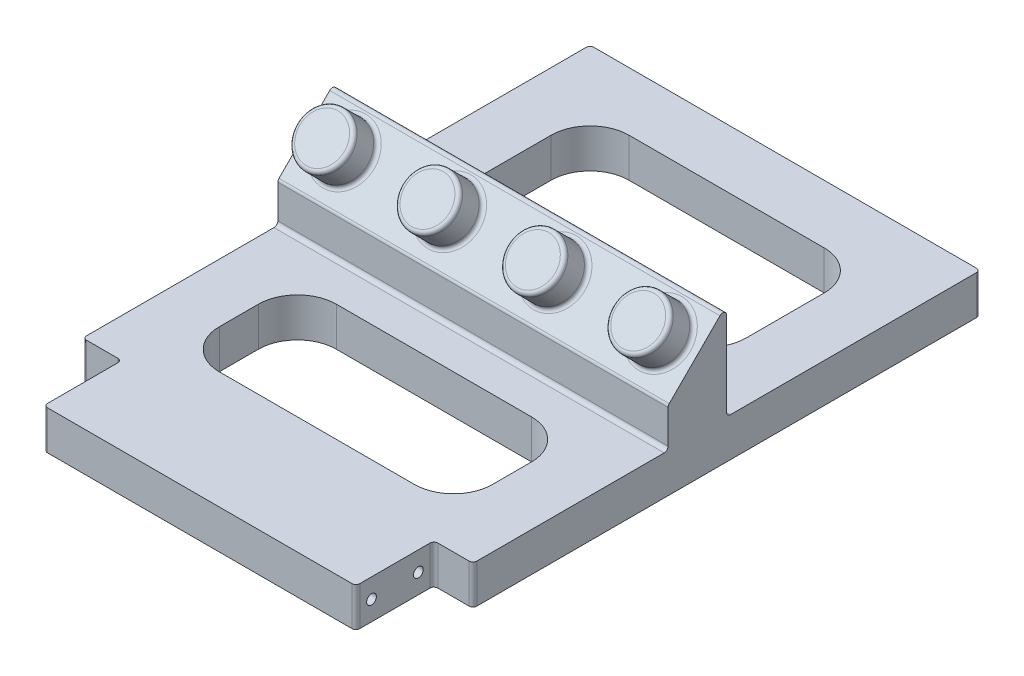
from build123d import *

# Parameters (mm, degrees)
SKETCH_1_W          = 100
SKETCH_1_H          = 150
EXTRUDE_1_DEPTH     = 5
SKETCH_6_W          = 20
SKETCH_6_H          = 10
CUT_EXTRUDE_2_DEPTH = 10
SKETCH_8_R          = 1.25
CUT_EXTRUDE_3_DEPTH = 15
EXTRUDE_3_DEPTH     = 100
SKETCH_10_R         = 6.75
EXTRUDE_4_DEPTH     = 8
FILLET_1_R          = 1
FILLET_2_R          = 1
SKETCH_11_W         = 70
SKETCH_11_H         = 40
SKETCH_11_H_2       = 30
CUT_EXTRUDE_4_DEPTH = 95.24494087
FILLET_3_R          = 10


with BuildPart() as part:
    # 草图1 → 凸台-拉伸1 (new, symmetric)
    with BuildSketch(Plane(origin=(0, 0, 0), x_dir=(1, 0, 0), z_dir=(0, 1, 0))):
        Rectangle(SKETCH_1_W, SKETCH_1_H)
    extrude(amount=EXTRUDE_1_DEPTH, both=True)

    # 草图6 → 切除-拉伸2 (cut)
    with BuildSketch(Plane(origin=(50, 0, 0), x_dir=(0, 0, -1), z_dir=(1, 0, 0))):
        with Locations((-65, 0)):
            Rectangle(SKETCH_6_W, SKETCH_6_H)
    cut_extrude_2 = extrude(amount=-CUT_EXTRUDE_2_DEPTH, mode=Mode.SUBTRACT)

    # 草图8 → 切除-拉伸3 (cut)
    with BuildSketch(Plane(origin=(40, 0, 0), x_dir=(0, 0, -1), z_dir=(1, 0, 0))):
        with Locations((-71, 0)):
            Circle(SKETCH_8_R)
        with Locations((-59, 0)):
            Circle(SKETCH_8_R)
    cut_extrude_3 = extrude(amount=-CUT_EXTRUDE_3_DEPTH, mode=Mode.SUBTRACT)

    # 镜向1: 切除-拉伸2, 切除-拉伸3 across plane
    add(cut_extrude_2.mirror(Plane(origin=(0, 0, 0), x_dir=(0, 0, 1), z_dir=(1, 0, 0))), mode=Mode.SUBTRACT)
    add(cut_extrude_3.mirror(Plane(origin=(0, 0, 0), x_dir=(0, 0, 1), z_dir=(1, 0, 0))), mode=Mode.SUBTRACT)

    # 草图9 → 凸台-拉伸3 (add)
    with BuildSketch(Plane(origin=(50, 0, 0), x_dir=(0, 0, -1), z_dir=(1, 0, 0))):
        Polygon((-5, 15), (-5, 5), (10, 5), (10, 15), (10, 30), align=None)
    extrude(amount=-EXTRUDE_3_DEPTH)

    # 草图10 → 凸台-拉伸4 (add)
    with BuildSketch(Plane(origin=(0, 10, 10), x_dir=(1, 0, 0), z_dir=(0, 0.7071067811865461, 0.7071067811865489))):
        with Locations(Location((40.5, 17.67766953, 0), (0, 0, 270))):
            Circle(SKETCH_10_R)
        with Locations(Location((-40.5, 17.67766953, 0), (0, 0, 270))):
            Circle(SKETCH_10_R)
        with Locations(Location((-13.5, 17.67766953, 0), (0, 0, 270))):
            Circle(SKETCH_10_R)
        with Locations(Location((13.5, 17.67766953, 0), (0, 0, 270))):
            Circle(SKETCH_10_R)
    extrude(amount=EXTRUDE_4_DEPTH)

    # 圆角1
    fillet_1_edges = [part.edges().sort_by_distance(p)[0] for p in [
        (-40.5, 27.272970773, -7.272970773),
        (-40.5, 32.929825023, -1.616116524),
        (40.5, 27.272970773, -7.272970773),
        (40.5, 32.929825023, -1.616116524),
        (-13.5, 27.272970773, -7.272970773),
        (-13.5, 32.929825023, -1.616116524),
        (13.5, 27.272970773, -7.272970773),
        (13.5, 32.929825023, -1.616116524),
        (0, 5, -10),
        (0, 5, 5),
        (0, 15, 5),
        (0, 30, -10),
    ]]
    fillet(fillet_1_edges, radius=FILLET_1_R)

    # 圆角2
    fillet_2_edges = [part.edges().sort_by_distance(p)[0] for p in [
        (40, 0, 75),
        (40, 0, 55),
        (50, 0, 55),
        (-50, 0, 55),
        (-40, 0, 75),
        (-40, 0, 55),
        (-50, 0, -75),
        (50, 0, -75),
    ]]
    fillet(fillet_2_edges, radius=FILLET_2_R)

    # 草图11 → 切除-拉伸4 (cut, through all)
    with BuildSketch(Plane(origin=(0, 5, 0), x_dir=(1, 0, 0), z_dir=(0, 1, 0))):
        with Locations((0, 40)):
            Rectangle(SKETCH_11_W, SKETCH_11_H)
        with Locations((0, -30)):
            Rectangle(SKETCH_11_W, SKETCH_11_H_2)
    extrude(amount=-CUT_EXTRUDE_4_DEPTH, mode=Mode.SUBTRACT)

    # 圆角3
    fillet_3_edges = [part.edges().sort_by_distance(p)[0] for p in [
        (35, 0, -60),
        (35, 0, -20),
        (-35, 0, -20),
        (-35, 0, -60),
        (35, 0, 15),
        (35, 0, 45),
        (-35, 0, 45),
        (-35, 0, 15),
    ]]
    fillet(fillet_3_edges, radius=FILLET_3_R)


solid = part.part
